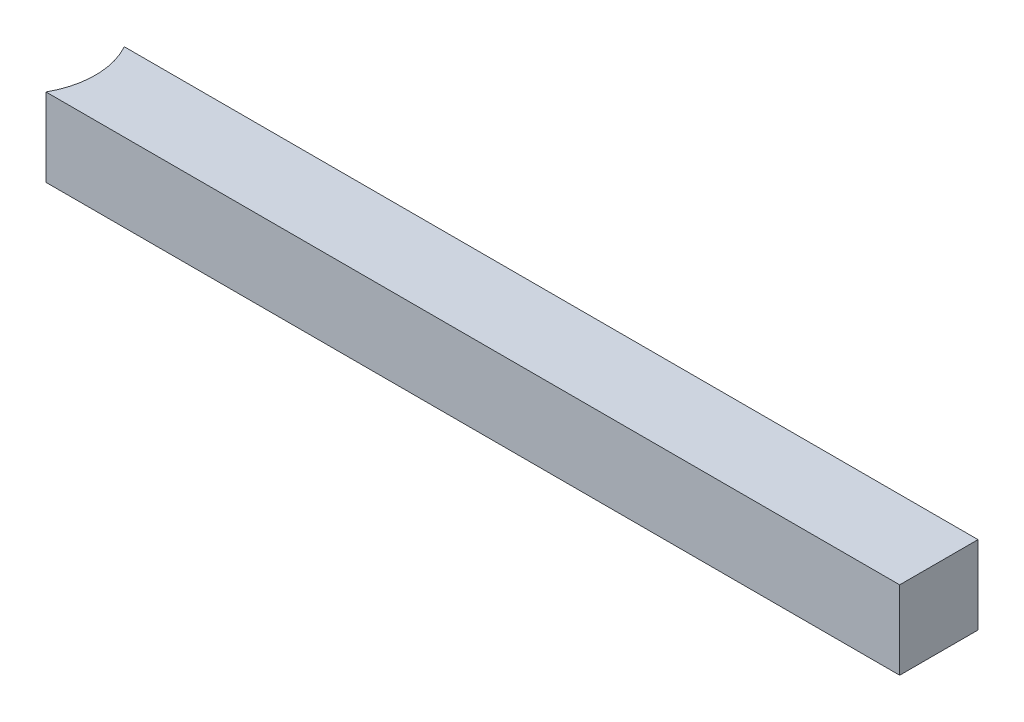
from build123d import *

# Parameters (mm, degrees)
SKETCH1_W               = 25.4
SKETCH1_H               = 25.4
BOSS_EXTRUDE1_DEPTH     = 306.07
CUT_EXTRUDE1_DEPTH      = 308.384604201
CUT_EXTRUDE1_DEPTH_BACK = 308.384604201


with BuildPart() as part:
    # Sketch1 → Boss-Extrude1 (new body)
    with BuildSketch(Plane(origin=(0, 0, 0), x_dir=(0, 0, -1), z_dir=(1, 0, 0))):
        Rectangle(SKETCH1_W, SKETCH1_H)
    extrude(amount=BOSS_EXTRUDE1_DEPTH)

    # Sketch2 → Cut-Extrude1 (cut, two sides: drawn at the far end of the back side and taken through both)
    with BuildSketch(Plane(origin=(0, 12.7, 0), x_dir=(1, 0, 0), z_dir=(0, 1, 0)).offset(-CUT_EXTRUDE1_DEPTH_BACK)):
        with BuildLine():
            Line((29.21, -12.7), (0, -12.7))
            Line((0, -12.7), (0, 12.7))
            Line((0, 12.7), (29.21, 12.7))
            ThreePointArc((29.21, 12.7), (32.517676686, 0), (29.21, -12.7))
        make_face()
    extrude(amount=CUT_EXTRUDE1_DEPTH + CUT_EXTRUDE1_DEPTH_BACK, mode=Mode.SUBTRACT)


solid = part.part
